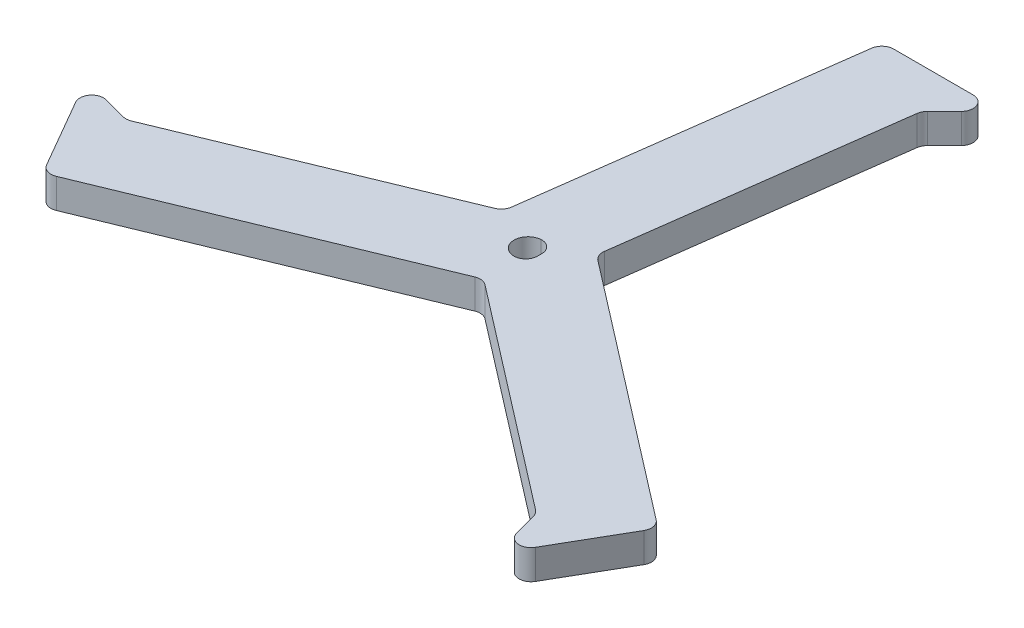
from build123d import *

# Parameters (mm, degrees)
BOSS_EXTRUDE1_DEPTH = 6.35
FILLET1_R           = 2.54


with BuildPart() as part:
    # Sketch2 → Boss-Extrude1 (new body)
    with BuildSketch(Plane(origin=(0, 0, 0), x_dir=(1, 0, 0), z_dir=(0, 1, 0))):
        Polygon((0, 76.2), (25.4, 76.2), (16.813378089, 67.613378089), (8.597359078, 6.114164014), (65.991135768, -38.1), (53.291135768, -60.097045256), (50.148214016, -48.367501593), (0.99634182, -10.502613374), (-65.991135768, -38.1), (-78.691135768, -16.102954744), (-66.961592105, -19.245876496), (-9.593700898, 4.38844936), align=None)
        with BuildLine():
            Line((2.499994, 1.658310586), (2.499994, -1.658310586))
            ThreePointArc((2.499994, -1.658310586), (-2.999994, 0), (2.499994, 1.658310586))
        make_face(mode=Mode.SUBTRACT)
    extrude(amount=BOSS_EXTRUDE1_DEPTH)

    # Fillet1
    fillet1_edges = [part.edges().sort_by_distance(p)[0] for p in [
        (-65.991135768, 3.175, 38.1),
        (-78.691135768, 3.175, 16.102954744),
        (-66.961592105, 3.175, 19.245876496),
        (-9.593700898, 3.175, -4.38844936),
        (0, 3.175, -76.2),
        (25.4, 3.175, -76.2),
        (16.813378089, 3.175, -67.613378089),
        (8.597359078, 3.175, -6.114164014),
        (65.991135768, 3.175, 38.1),
        (53.291135768, 3.175, 60.097045256),
        (50.148214016, 3.175, 48.367501593),
        (0.99634182, 3.175, 10.502613374),
        (2.499994, 3.175, 1.658310586),
        (2.499994, 3.175, -1.658310586),
    ]]
    fillet(fillet1_edges, radius=FILLET1_R)


solid = part.part
